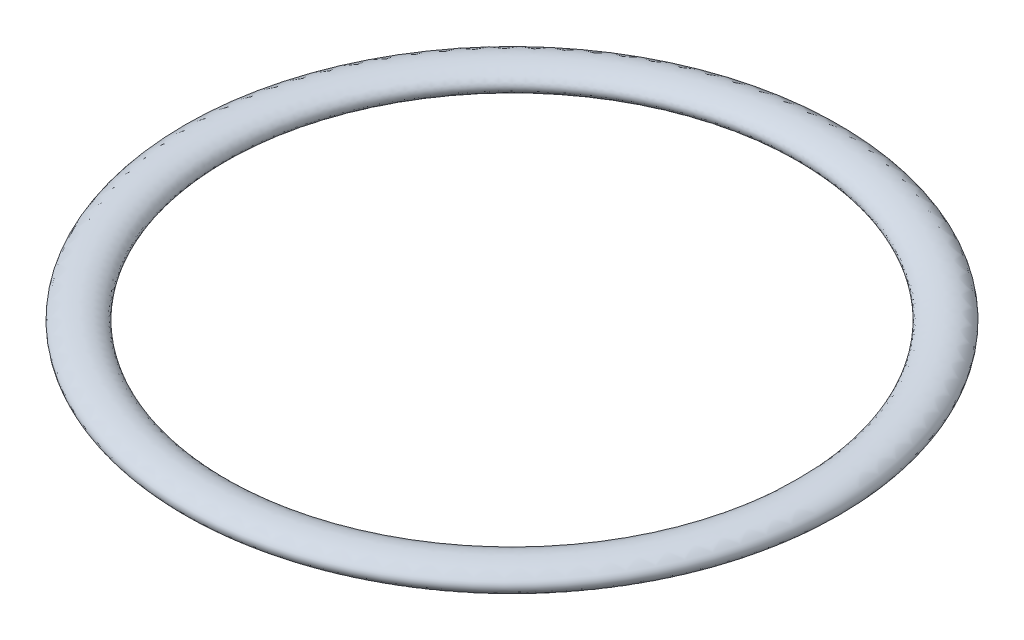
from build123d import *

# Parameters (mm, degrees)
RECONSTRUCTED_NOMINAL_AXIAL_PROFILE_RX = 1.384924905
RECONSTRUCTED_NOMINAL_AXIAL_PROFILE_RY = 0.725


with BuildPart() as part:
    # Reconstructed nominal axial profile → Native revolved geometry (revolve)
    with BuildSketch(Plane.XY):
        with Locations((18.425, 0)):
            Ellipse(RECONSTRUCTED_NOMINAL_AXIAL_PROFILE_RX, RECONSTRUCTED_NOMINAL_AXIAL_PROFILE_RY)
    revolve(axis=Axis((0, -500, 0), (0, 1, 0)))


solid = part.part
